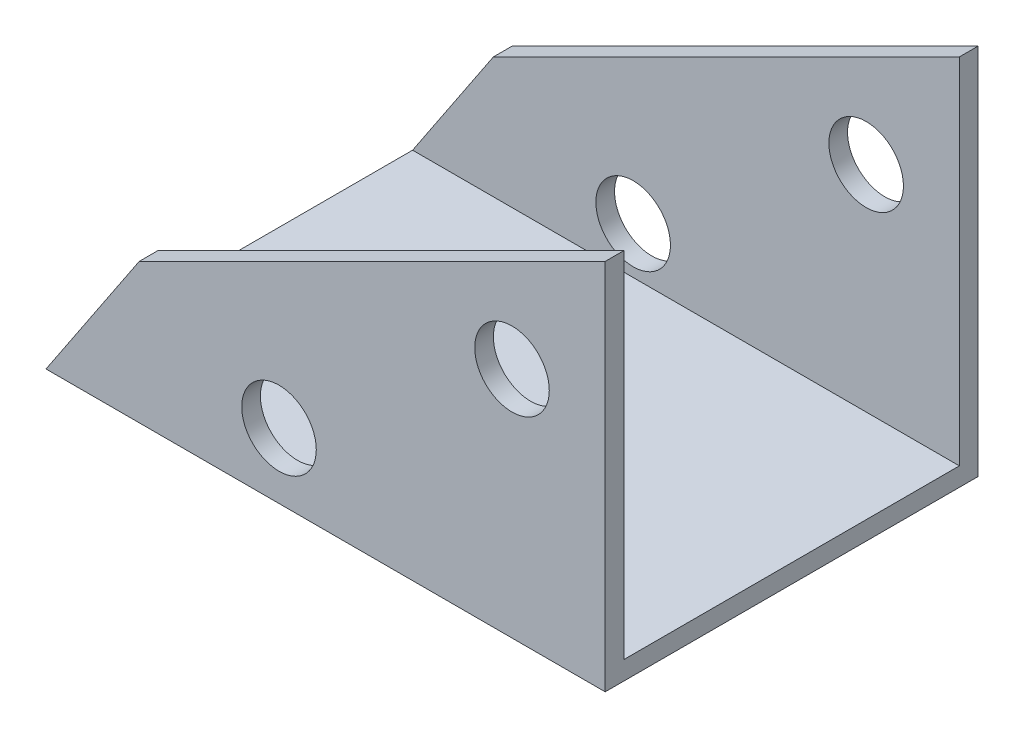
from build123d import *

# Parameters (mm, degrees)
SKETCH1_W           = 60
SKETCH1_H           = 40
BOSS_EXTRUDE1_DEPTH = 40
SKETCH5_W           = 36
SKETCH5_H           = 38
CUT_EXTRUDE3_DEPTH  = 83.462112512
SKETCH6_R           = 4
CUT_EXTRUDE4_DEPTH  = 83.462112512


with BuildPart() as part:
    # Sketch1 → Boss-Extrude1 (new body)
    with BuildSketch(Plane(origin=(0, 0, 0), x_dir=(1, 0, 0), z_dir=(0, 1, 0))):
        with Locations((30, 20)):
            Rectangle(SKETCH1_W, SKETCH1_H)
    extrude(amount=BOSS_EXTRUDE1_DEPTH)

    # Sketch5 → Cut-Extrude3 (cut, through all)
    with BuildSketch(Plane(origin=(60, 0, 0), x_dir=(0, 0, -1), z_dir=(1, 0, 0))):
        with Locations((20, 21)):
            Rectangle(SKETCH5_W, SKETCH5_H)
    extrude(amount=-CUT_EXTRUDE3_DEPTH, mode=Mode.SUBTRACT)

    # Sketch6 → Cut-Extrude4 (cut, through all)
    with BuildSketch(Plane.XY):
        Polygon((10, 15), (0, 0), (0, 40), (60, 40), align=None)
        with Locations((25, 7)):
            Circle(SKETCH6_R)
        with Locations((50, 25)):
            Circle(SKETCH6_R)
    extrude(amount=-CUT_EXTRUDE4_DEPTH, mode=Mode.SUBTRACT)


solid = part.part
